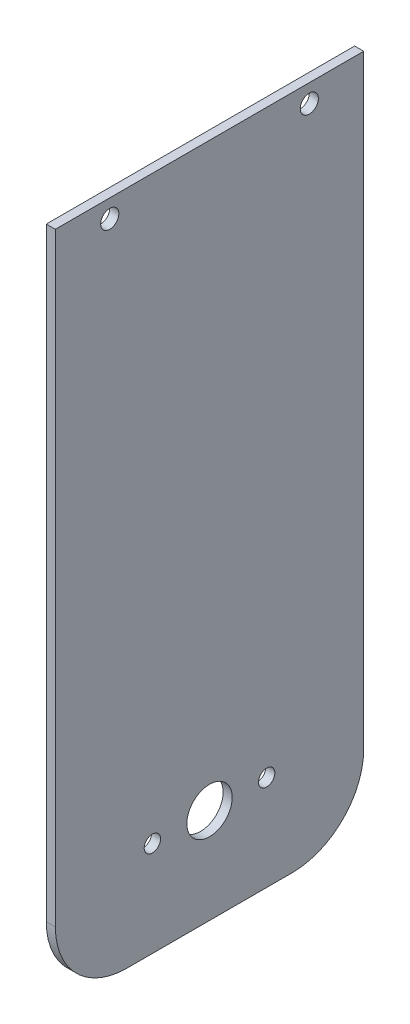
from build123d import *

# Parameters (mm, degrees)
SKETCH1_W           = 107.95
SKETCH1_H           = 236.535
SKETCH1_R           = 7.94
SKETCH1_R_2         = 2.86
SKETCH1_R_3         = 3.175
BOSS_EXTRUDE1_DEPTH = 3.175
FILLET1_R           = 25


with BuildPart() as part:
    # Sketch1 → Boss-Extrude1 (new body)
    with BuildSketch(Plane(origin=(0, 0, 0), x_dir=(0, 0, -1), z_dir=(1, 0, 0))):
        Rectangle(SKETCH1_W, SKETCH1_H)
        with Locations((0, -84.9275)):
            Circle(SKETCH1_R, mode=Mode.SUBTRACT)
        with Locations((20, -84.9275)):
            Circle(SKETCH1_R_2, mode=Mode.SUBTRACT)
        with Locations((-20, -84.9275)):
            Circle(SKETCH1_R_2, mode=Mode.SUBTRACT)
        with Locations((-34.925, 111.9175)):
            Circle(SKETCH1_R_3, mode=Mode.SUBTRACT)
        with Locations((34.925, 111.9175)):
            Circle(SKETCH1_R_3, mode=Mode.SUBTRACT)
    extrude(amount=BOSS_EXTRUDE1_DEPTH)

    # Fillet1
    fillet1_edges = [part.edges().sort_by_distance(p)[0] for p in [
        (1.5875, -118.2675, -53.975),
        (1.5875, -118.2675, 53.975),
    ]]
    fillet(fillet1_edges, radius=FILLET1_R)


solid = part.part
